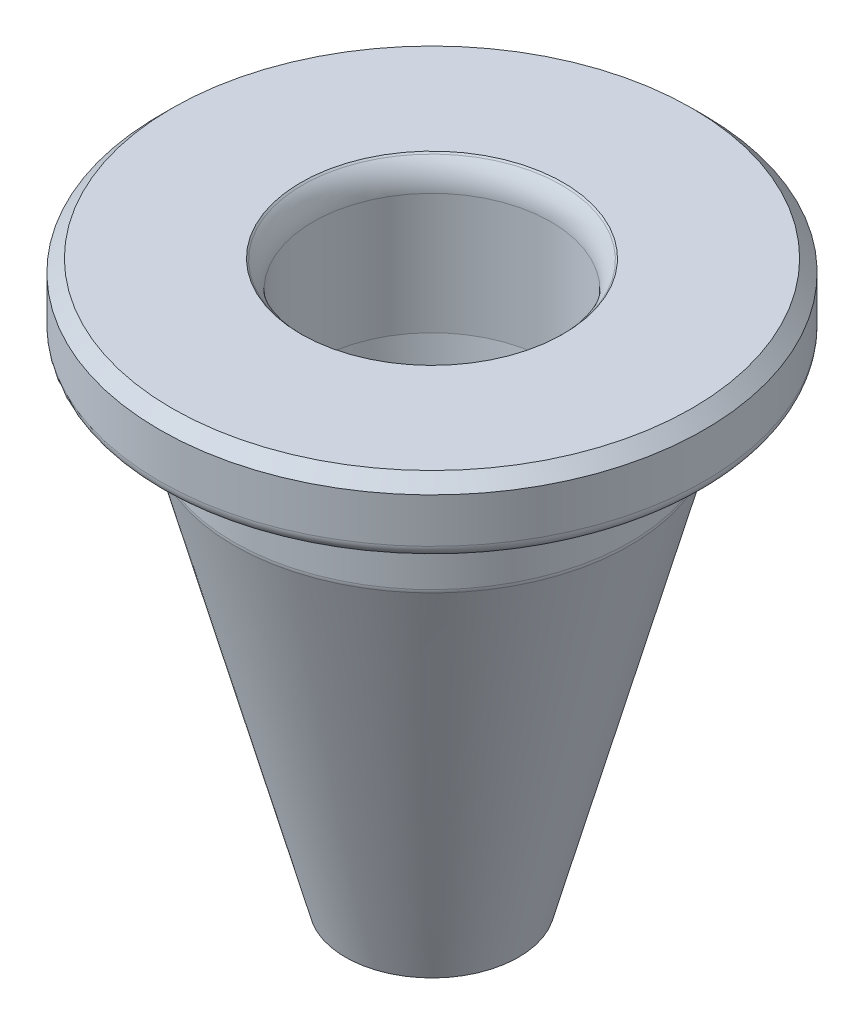
from build123d import *

# Parameters (mm, degrees)
FL_CHE_VERSCHIEBEN1_BY          = 1
AUFSATZ_LINEAR_START            = -2.8
SKIZZE2_R                       = 11
SKIZZE2_R_2                     = 4.8
AUFSATZ_LINEAR_AUSTRAGEN1_DEPTH = 2.8
VERRUNDUNG1_R                   = 0.5
FASE1_SIZE                      = 0.5
VERRUNDUNG2_R                   = 1.5


with BuildPart() as part:
    # Skizze1 → Rotation1 (revolve)
    with BuildSketch(Plane.XY, mode=Mode.PRIVATE) as rotation1_sk:
        Polygon((3, 0), (4.8, 17), (4.8, 22), (8, 22), (8, 17), (3.5, 0.3), align=None)
    revolve(rotation1_sk.sketch.rotate(Axis((0, 0, 0), (0, 1, 0)), 90), axis=Axis((0, 0, 0), (0, 1, 0)))

    # Fläche verschieben1: a face moved outward by 1.0
    extrude(part.faces().sort_by_distance((6.4, 22, 0))[0], amount=FL_CHE_VERSCHIEBEN1_BY, dir=(0, 1, 0))

    # Skizze2 → Aufsatz-Linear austragen1 (add)
    with BuildSketch(Plane(origin=(0, 23, 0), x_dir=(1, 0, 0), z_dir=(0, 1, 0)).offset(AUFSATZ_LINEAR_START)):
        with Locations(Location((0, 0, 0), (0, 0, 270))):
            Circle(SKIZZE2_R)
        with Locations(Location((0, 0, 0), (0, 0, 90))):
            Circle(SKIZZE2_R_2, mode=Mode.SUBTRACT)
    extrude(amount=AUFSATZ_LINEAR_AUSTRAGEN1_DEPTH)

    # Verrundung1
    verrundung1_edges = [part.edges().sort_by_distance(p)[0] for p in [
        (0, 20.2, 8),
        (0, 20.2, -11),
        (0, 17, 8),
    ]]
    fillet(verrundung1_edges, radius=VERRUNDUNG1_R)

    # Fase1
    fase1_edges = [part.edges().sort_by_distance(p)[0] for p in [
        (0, 23, -11),
        (0, 23, 4.8),
    ]]
    chamfer(fase1_edges, length=FASE1_SIZE)

    # Verrundung2
    verrundung2_edges = [part.edges().sort_by_distance(p)[0] for p in [
        (0, 22.5, 4.8),
    ]]
    fillet(verrundung2_edges, radius=VERRUNDUNG2_R)


solid = part.part
